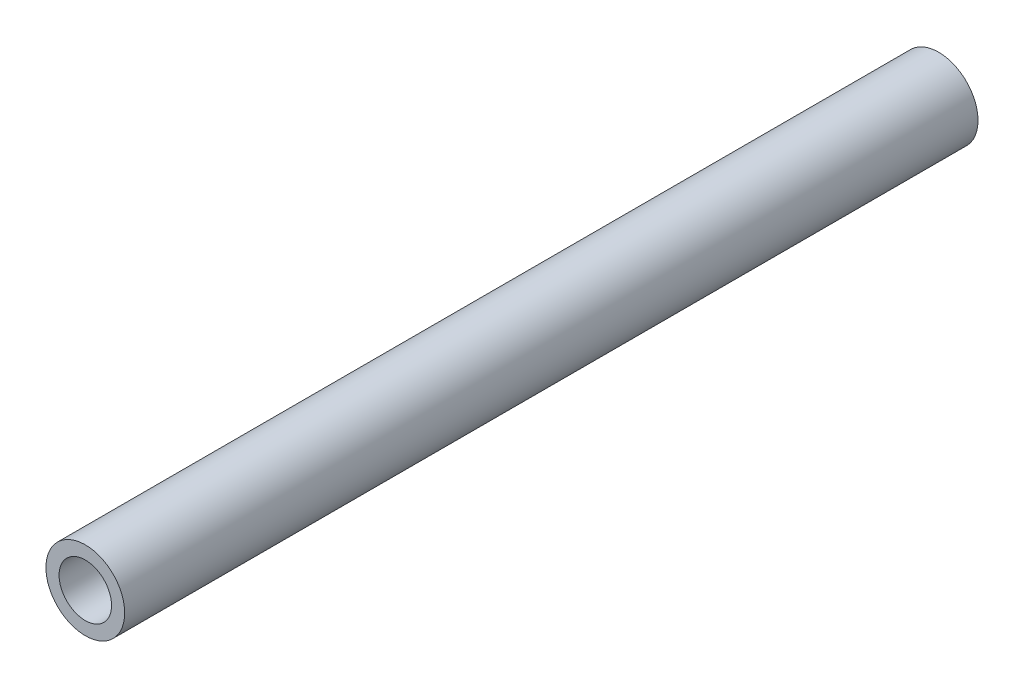
from build123d import *

# Parameters (mm, degrees)
SKETCH1_R           = 15
SKETCH1_R_2         = 10
BOSS_EXTRUDE1_DEPTH = 162.5


with BuildPart() as part:
    # Sketch1 → Boss-Extrude1 (new, symmetric)
    with BuildSketch(Plane(origin=(0, 0, 0), x_dir=(0, 1, 0), z_dir=(0, 0, 1))):
        with Locations(Location((0, 0, 0), (0, 0, 270))):
            Circle(SKETCH1_R)
        with Locations(Location((0, 0, 0), (0, 0, 270))):
            Circle(SKETCH1_R_2, mode=Mode.SUBTRACT)
    extrude(amount=BOSS_EXTRUDE1_DEPTH, both=True)


solid = part.part
